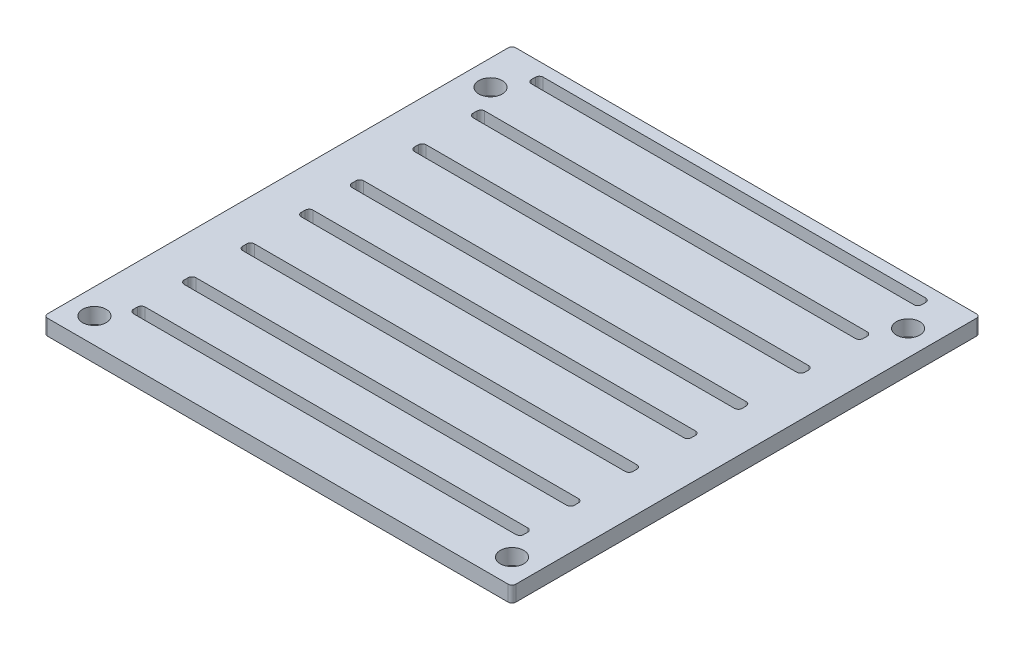
from build123d import *

# Parameters (mm, degrees)
SKETCH1_W           = 120
SKETCH1_H           = 120
SKETCH1_R           = 3
SKETCH1_W_2         = 100
SKETCH1_H_2         = 3
BOSS_EXTRUDE1_DEPTH = 4
FILLET1_R           = 1
FILLET2_R           = 1


with BuildPart() as part:
    # Sketch1 → Boss-Extrude1 (new body)
    with BuildSketch(Plane(origin=(0, 0, 0), x_dir=(1, 0, 0), z_dir=(0, 1, 0))):
        with Locations((60, 60)):
            Rectangle(SKETCH1_W, SKETCH1_H)
        with Locations(Location((113.5, 6.5, 0), (0, 0, 270))):
            Circle(SKETCH1_R, mode=Mode.SUBTRACT)
        with Locations(Location((6.5, 6.5, 0), (0, 0, 270))):
            Circle(SKETCH1_R, mode=Mode.SUBTRACT)
        with Locations(Location((113.5, 108, 0), (0, 0, 270))):
            Circle(SKETCH1_R, mode=Mode.SUBTRACT)
        with Locations(Location((6.5, 108, 0), (0, 0, 270))):
            Circle(SKETCH1_R, mode=Mode.SUBTRACT)
        with Locations((60, 13.5)):
            Rectangle(SKETCH1_W_2, SKETCH1_H_2, mode=Mode.SUBTRACT)
        with Locations((60, 69.5)):
            Rectangle(SKETCH1_W_2, SKETCH1_H_2, mode=Mode.SUBTRACT)
        with Locations((60, 26.5)):
            Rectangle(SKETCH1_W_2, SKETCH1_H_2, mode=Mode.SUBTRACT)
        with Locations((60, 41.5)):
            Rectangle(SKETCH1_W_2, SKETCH1_H_2, mode=Mode.SUBTRACT)
        with Locations((60, 56.5)):
            Rectangle(SKETCH1_W_2, SKETCH1_H_2, mode=Mode.SUBTRACT)
        with Locations((60, 85.5)):
            Rectangle(SKETCH1_W_2, SKETCH1_H_2, mode=Mode.SUBTRACT)
        with Locations((60, 100.5)):
            Rectangle(SKETCH1_W_2, SKETCH1_H_2, mode=Mode.SUBTRACT)
        with Locations((60, 115.5)):
            Rectangle(SKETCH1_W_2, SKETCH1_H_2, mode=Mode.SUBTRACT)
    extrude(amount=-BOSS_EXTRUDE1_DEPTH)

    # Fillet1
    fillet1_edges = [part.edges().sort_by_distance(p)[0] for p in [
        (110, -2, -15),
        (10, -2, -15),
        (10, -2, -12),
        (110, -2, -12),
        (110, -2, -28),
        (10, -2, -28),
        (10, -2, -25),
        (110, -2, -25),
        (110, -2, -43),
        (10, -2, -43),
        (10, -2, -40),
        (110, -2, -40),
        (110, -2, -58),
        (10, -2, -58),
        (10, -2, -55),
        (110, -2, -55),
        (110, -2, -71),
        (10, -2, -71),
        (10, -2, -68),
        (110, -2, -68),
        (110, -2, -87),
        (10, -2, -87),
        (10, -2, -84),
        (110, -2, -84),
        (110, -2, -102),
        (10, -2, -102),
        (10, -2, -99),
        (110, -2, -99),
        (110, -2, -117),
        (10, -2, -117),
        (10, -2, -114),
        (110, -2, -114),
    ]]
    fillet(fillet1_edges, radius=FILLET1_R)

    # Fillet2
    fillet2_edges = [part.edges().sort_by_distance(p)[0] for p in [
        (0, -2, 0),
        (0, -2, -120),
        (120, -2, -120),
        (120, -2, 0),
    ]]
    fillet(fillet2_edges, radius=FILLET2_R)


solid = part.part
